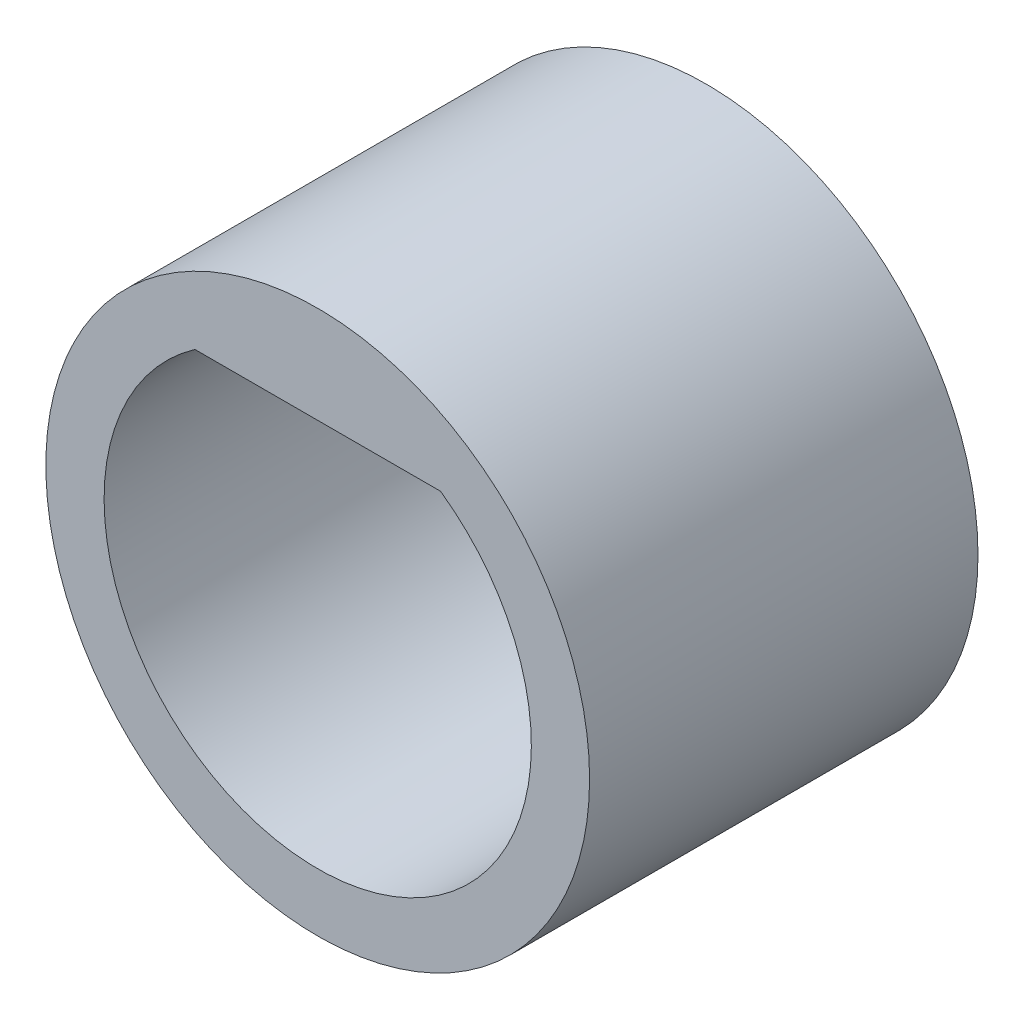
from build123d import *

# Parameters (mm, degrees)
SKETCH1_R           = 7
BOSS_EXTRUDE2_DEPTH = 10


with BuildPart() as part:
    # Sketch1 → Boss-Extrude2 (new body)
    with BuildSketch(Plane.XY):
        with Locations((7.223861929, 0)):
            Circle(SKETCH1_R)
        with BuildLine():
            Line((4.061584269, 4.5), (10.386139589, 4.5))
            ThreePointArc((10.386139589, 4.5), (7.223861929, -5.5), (4.061584269, 4.5))
        make_face(mode=Mode.SUBTRACT)
    extrude(amount=BOSS_EXTRUDE2_DEPTH)


solid = part.part
